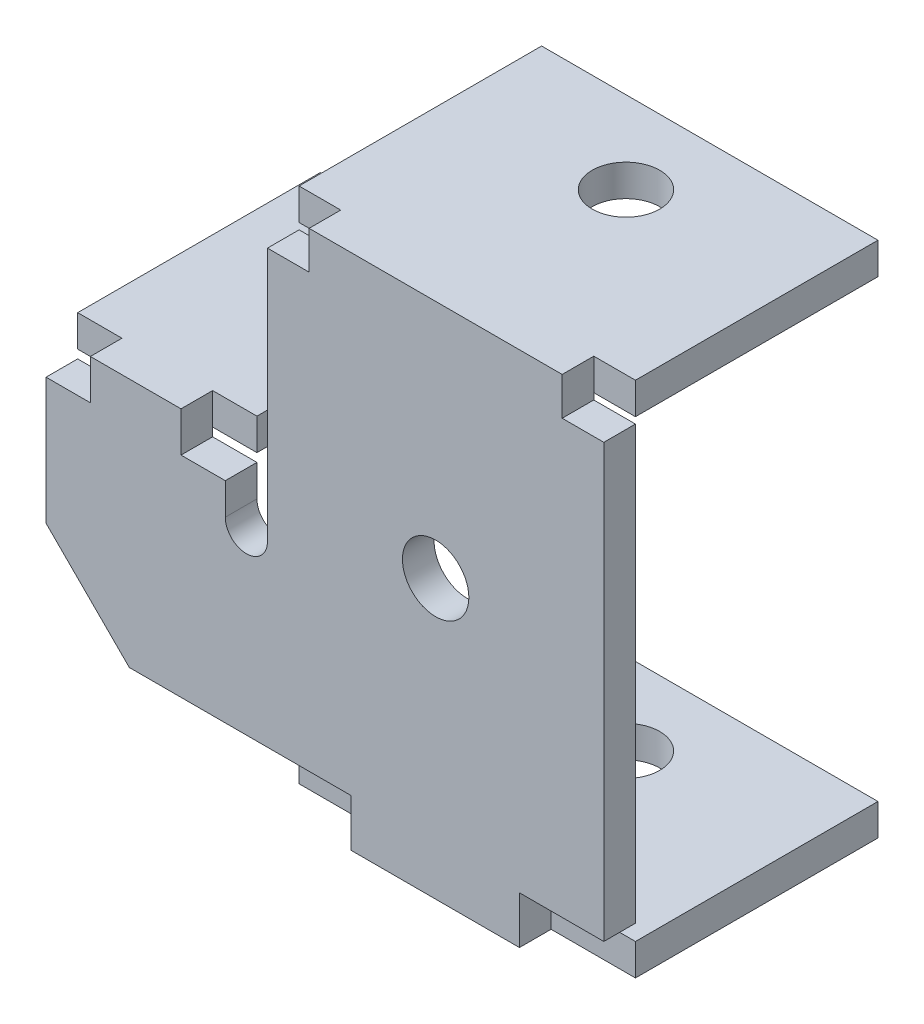
from build123d import *

# Parameters (mm, degrees)
SKETCH1_R           = 1.575
BOSS_EXTRUDE1_DEPTH = 1.5
SKETCH2_W           = 15.95
SKETCH2_H           = 1.5
SKETCH2_W_2         = 8.5
BOSS_EXTRUDE2_DEPTH = 11.5
SKETCH3_R           = 1.6
CUT_EXTRUDE1_DEPTH  = 38.875519798


with BuildPart() as part:
    # Sketch1 → Boss-Extrude1 (new body)
    with BuildSketch(Plane.XY):
        with BuildLine():
            Line((0, -10.25), (0, 10.25))
            Line((0, 10.25), (-1.975, 10.25))
            Line((-1.975, 10.25), (-1.975, 12.05))
            Line((-1.975, 12.05), (-13.975, 12.05))
            Line((-13.975, 12.05), (-13.975, 10.25))
            Line((-13.975, 10.25), (-15.95, 10.25))
            Line((-15.95, 10.25), (-15.95, -1.8))
            ThreePointArc((-15.95, -1.8), (-16.95, -2.8), (-17.95, -1.8))
            Line((-17.95, -1.8), (-17.95, -0.3))
            Line((-17.95, -0.3), (-20.05, -0.3))
            Line((-20.05, -0.3), (-20.05, 1.6))
            Line((-20.05, 1.6), (-24.35, 1.6))
            Line((-24.35, 1.6), (-24.35, -0.3))
            Line((-24.35, -0.3), (-26.45, -0.3))
            Line((-26.45, -0.3), (-26.45, -6.3))
            Line((-26.45, -6.3), (-22.5, -10.25))
            Line((-22.5, -10.25), (-12, -10.25))
            Line((-12, -10.25), (-12, -12.5))
            Line((-12, -12.5), (-4, -12.5))
            Line((-4, -12.5), (-4, -10.25))
            Line((-4, -10.25), (0, -10.25))
        make_face()
        with Locations((-7.975, 0.675)):
            Circle(SKETCH1_R, mode=Mode.SUBTRACT)
    extrude(amount=BOSS_EXTRUDE1_DEPTH)

    # Sketch2 → Boss-Extrude2 (add)
    with BuildSketch(Plane(origin=(0, 0, 0), x_dir=(-1, 0, 0), z_dir=(0, 0, -1))):
        with Locations((7.975, 11.3)):
            Rectangle(SKETCH2_W, SKETCH2_H)
        with Locations((7.975, -11.75)):
            Rectangle(SKETCH2_W, SKETCH2_H)
        with Locations((22.2, 0.85)):
            Rectangle(SKETCH2_W_2, SKETCH2_H)
    extrude(amount=BOSS_EXTRUDE2_DEPTH)

    # Sketch3 → Cut-Extrude1 (cut, through all)
    with BuildSketch(Plane(origin=(0, 12.05, 0), x_dir=(1, 0, 0), z_dir=(0, 1, 0))):
        with Locations(Location((-8.05, 7.6, 0), (0, 0, 270))):
            Circle(SKETCH3_R)
        with Locations(Location((-22.45, 7.6, 0), (0, 0, 270))):
            Circle(SKETCH3_R)
    extrude(amount=-CUT_EXTRUDE1_DEPTH, mode=Mode.SUBTRACT)


solid = part.part
